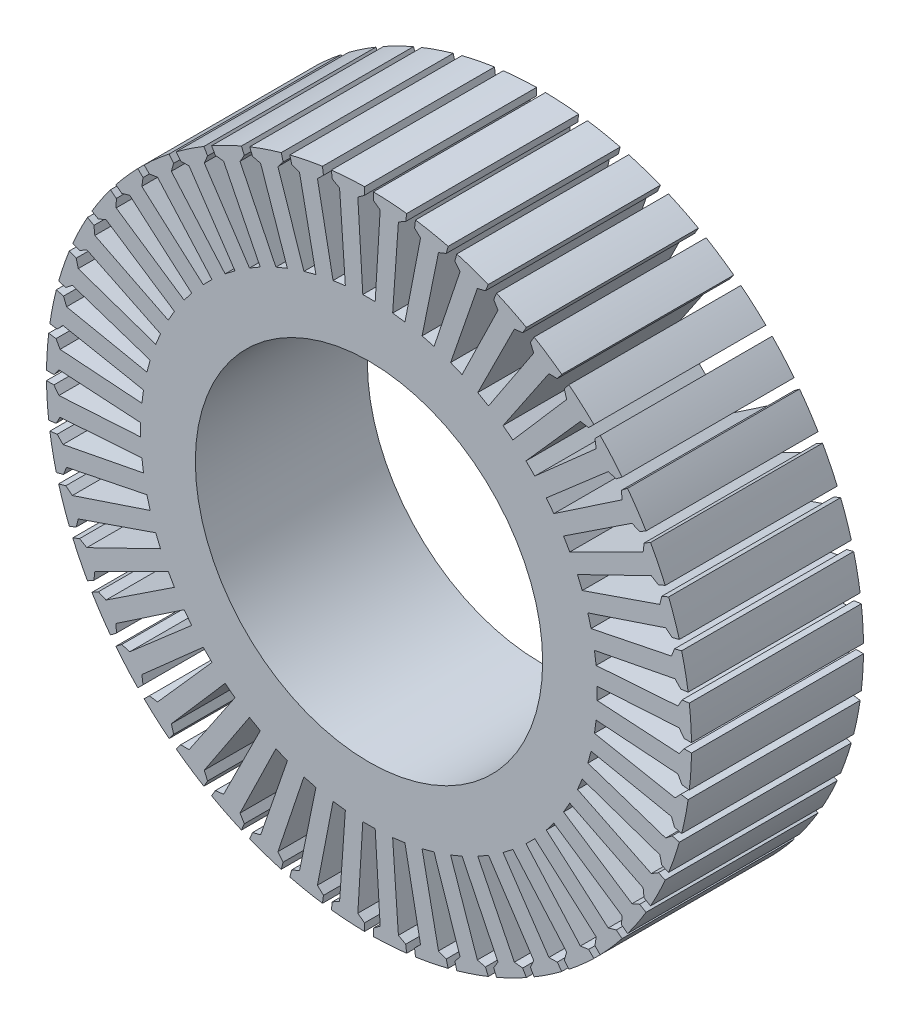
from build123d import *

# Parameters (mm, degrees)
STATOR_STACK_START    = -20
SKETCH_1_R            = 75
SKETCH_1_R_2          = 40.384615385
STATOR_STACK_DEPTH    = 40
STATOR_48_SLOTS_DEPTH = 21


with BuildPart() as part:
    # Эскиз1 → Stator_stack (new body)
    with BuildSketch(Plane.XY.offset(STATOR_STACK_START)):
        Circle(SKETCH_1_R)
        Circle(SKETCH_1_R_2, mode=Mode.SUBTRACT)
    extrude(amount=STATOR_STACK_DEPTH)

    # Эскиз2 → Stator_48_slots (cut, symmetric)
    with BuildSketch(Plane.XY):
        Polygon((75.992904916, -1.038461538), (73.269230769, -1.038461538), (72.115384615, -2.596153846), (53.076923077, -1.442307692), (53.076923077, 1.442307692), (72.115384615, 2.596153846), (73.269230769, 1.038461538), (75.992904916, 1.038461538), align=None)
        Polygon((75.478321511, 8.889487158), (72.777948773, 8.533976343), (71.837293579, 6.839003164), (52.811101573, 5.497960114), (52.434583711, 8.357897214), (71.159561427, 11.986889944), (72.506855913, 10.593131055), (75.20722865, 10.948641871), align=None)
        Polygon((73.672283097, 18.665334265), (71.041415896, 17.960395523), (70.330046532, 16.157142934), (51.64166748, 12.344156298), (50.89507408, 15.130480797), (68.986178413, 21.172527032), (70.503868649, 19.966549163), (73.13473585, 20.671487905), align=None)
        Polygon((70.605691494, 28.121812328), (68.089344696, 27.079507357), (67.61943289, 25.198829509), (49.588630138, 18.979140546), (48.484735621, 21.644177659), (65.632422761, 29.995896313), (67.294540645, 28.998334078), (69.810887442, 30.040639049), align=None)
        Polygon((66.331016934, 37.097118385), (63.972245931, 35.735281311), (63.751832004, 33.809357125), (46.687117585, 25.289386437), (45.244809893, 27.78753664), (61.155678158, 38.306027491), (62.933784393, 37.533949458), (65.292555396, 38.895786531), align=None)
        Polygon((60.921400284, 45.437682461), (58.760564301, 43.779614695), (58.793419596, 41.841397266), (42.986775507, 31.166923914), (41.230732924, 33.455443165), (55.632542946, 45.960731918), (57.496213641, 45.427348556), (59.657049624, 47.085416322), align=None)
        Polygon((54.469401584, 53.000795193), (52.543473125, 51.074866733), (52.829035479, 49.1575195), (38.550917782, 36.511186682), (36.511186682, 38.550917782), (49.1575195, 52.829035479), (51.074866733, 52.543473125), (53.000795193, 54.469401584), align=None)
        Polygon((47.085416322, 59.657049624), (45.427348556, 57.496213641), (45.960731918, 55.632542946), (33.455443165, 41.230732924), (31.166923914, 42.986775507), (41.841397266, 58.793419596), (43.779614695, 58.760564301), (45.437682461, 60.921400284), align=None)
        Polygon((38.895786531, 65.292555396), (37.533949458, 62.933784393), (38.306027491, 61.155678158), (27.78753664, 45.244809893), (25.289386437, 46.687117585), (33.809357125, 63.751832004), (35.735281311, 63.972245931), (37.097118385, 66.331016934), align=None)
        Polygon((30.040639049, 69.810887442), (28.998334078, 67.294540645), (29.995896313, 65.632422761), (21.644177659, 48.484735621), (18.979140546, 49.588630138), (25.198829509, 67.61943289), (27.079507357, 68.089344696), (28.121812328, 70.605691494), align=None)
        Polygon((20.671487905, 73.13473585), (19.966549163, 70.503868649), (21.172527032, 68.986178413), (15.130480797, 50.89507408), (12.344156298, 51.64166748), (16.157142934, 70.330046532), (17.960395523, 71.041415896), (18.665334265, 73.672283097), align=None)
        Polygon((10.948641871, 75.20722865), (10.593131055, 72.506855913), (11.986889944, 71.159561427), (8.357897214, 52.434583711), (5.497960114, 52.811101573), (6.839003164, 71.837293579), (8.533976343, 72.777948773), (8.889487158, 75.478321511), align=None)
        Polygon((1.038461538, 75.992904916), (1.038461538, 73.269230769), (2.596153846, 72.115384615), (1.442307692, 53.076923077), (-1.442307692, 53.076923077), (-2.596153846, 72.115384615), (-1.038461538, 73.269230769), (-1.038461538, 75.992904916), align=None)
        Polygon((-8.889487158, 75.478321511), (-8.533976343, 72.777948773), (-6.839003164, 71.837293579), (-5.497960114, 52.811101573), (-8.357897214, 52.434583711), (-11.986889944, 71.159561427), (-10.593131055, 72.506855913), (-10.948641871, 75.20722865), align=None)
        Polygon((-18.665334265, 73.672283097), (-17.960395523, 71.041415896), (-16.157142934, 70.330046532), (-12.344156298, 51.64166748), (-15.130480797, 50.89507408), (-21.172527032, 68.986178413), (-19.966549163, 70.503868649), (-20.671487905, 73.13473585), align=None)
        Polygon((-28.121812328, 70.605691494), (-27.079507357, 68.089344696), (-25.198829509, 67.61943289), (-18.979140546, 49.588630138), (-21.644177659, 48.484735621), (-29.995896313, 65.632422761), (-28.998334078, 67.294540645), (-30.040639049, 69.810887442), align=None)
        Polygon((-37.097118385, 66.331016934), (-35.735281311, 63.972245931), (-33.809357125, 63.751832004), (-25.289386437, 46.687117585), (-27.78753664, 45.244809893), (-38.306027491, 61.155678158), (-37.533949458, 62.933784393), (-38.895786531, 65.292555396), align=None)
        Polygon((-45.437682461, 60.921400284), (-43.779614695, 58.760564301), (-41.841397266, 58.793419596), (-31.166923914, 42.986775507), (-33.455443165, 41.230732924), (-45.960731918, 55.632542946), (-45.427348556, 57.496213641), (-47.085416322, 59.657049624), align=None)
        Polygon((-53.000795193, 54.469401584), (-51.074866733, 52.543473125), (-49.1575195, 52.829035479), (-36.511186682, 38.550917782), (-38.550917782, 36.511186682), (-52.829035479, 49.1575195), (-52.543473125, 51.074866733), (-54.469401584, 53.000795193), align=None)
        Polygon((-59.657049624, 47.085416322), (-57.496213641, 45.427348556), (-55.632542946, 45.960731918), (-41.230732924, 33.455443165), (-42.986775507, 31.166923914), (-58.793419596, 41.841397266), (-58.760564301, 43.779614695), (-60.921400284, 45.437682461), align=None)
        Polygon((-65.292555396, 38.895786531), (-62.933784393, 37.533949458), (-61.155678158, 38.306027491), (-45.244809893, 27.78753664), (-46.687117585, 25.289386437), (-63.751832004, 33.809357125), (-63.972245931, 35.735281311), (-66.331016934, 37.097118385), align=None)
        Polygon((-69.810887442, 30.040639049), (-67.294540645, 28.998334078), (-65.632422761, 29.995896313), (-48.484735621, 21.644177659), (-49.588630138, 18.979140546), (-67.61943289, 25.198829509), (-68.089344696, 27.079507357), (-70.605691494, 28.121812328), align=None)
        Polygon((-73.13473585, 20.671487905), (-70.503868649, 19.966549163), (-68.986178413, 21.172527032), (-50.89507408, 15.130480797), (-51.64166748, 12.344156298), (-70.330046532, 16.157142934), (-71.041415896, 17.960395523), (-73.672283097, 18.665334265), align=None)
        Polygon((-75.20722865, 10.948641871), (-72.506855913, 10.593131055), (-71.159561427, 11.986889944), (-52.434583711, 8.357897214), (-52.811101573, 5.497960114), (-71.837293579, 6.839003164), (-72.777948773, 8.533976343), (-75.478321511, 8.889487158), align=None)
        Polygon((-75.992904916, 1.038461538), (-73.269230769, 1.038461538), (-72.115384615, 2.596153846), (-53.076923077, 1.442307692), (-53.076923077, -1.442307692), (-72.115384615, -2.596153846), (-73.269230769, -1.038461538), (-75.992904916, -1.038461538), align=None)
        Polygon((-75.478321511, -8.889487158), (-72.777948773, -8.533976343), (-71.837293579, -6.839003164), (-52.811101573, -5.497960114), (-52.434583711, -8.357897214), (-71.159561427, -11.986889944), (-72.506855913, -10.593131055), (-75.20722865, -10.948641871), align=None)
        Polygon((-73.672283097, -18.665334265), (-71.041415896, -17.960395523), (-70.330046532, -16.157142934), (-51.64166748, -12.344156298), (-50.89507408, -15.130480797), (-68.986178413, -21.172527032), (-70.503868649, -19.966549163), (-73.13473585, -20.671487905), align=None)
        Polygon((-70.605691494, -28.121812328), (-68.089344696, -27.079507357), (-67.61943289, -25.198829509), (-49.588630138, -18.979140546), (-48.484735621, -21.644177659), (-65.632422761, -29.995896313), (-67.294540645, -28.998334078), (-69.810887442, -30.040639049), align=None)
        Polygon((-66.331016934, -37.097118385), (-63.972245931, -35.735281311), (-63.751832004, -33.809357125), (-46.687117585, -25.289386437), (-45.244809893, -27.78753664), (-61.155678158, -38.306027491), (-62.933784393, -37.533949458), (-65.292555396, -38.895786531), align=None)
        Polygon((-60.921400284, -45.437682461), (-58.760564301, -43.779614695), (-58.793419596, -41.841397266), (-42.986775507, -31.166923914), (-41.230732924, -33.455443165), (-55.632542946, -45.960731918), (-57.496213641, -45.427348556), (-59.657049624, -47.085416322), align=None)
        Polygon((-54.469401584, -53.000795193), (-52.543473125, -51.074866733), (-52.829035479, -49.1575195), (-38.550917782, -36.511186682), (-36.511186682, -38.550917782), (-49.1575195, -52.829035479), (-51.074866733, -52.543473125), (-53.000795193, -54.469401584), align=None)
        Polygon((-47.085416322, -59.657049624), (-45.427348556, -57.496213641), (-45.960731918, -55.632542946), (-33.455443165, -41.230732924), (-31.166923914, -42.986775507), (-41.841397266, -58.793419596), (-43.779614695, -58.760564301), (-45.437682461, -60.921400284), align=None)
        Polygon((-38.895786531, -65.292555396), (-37.533949458, -62.933784393), (-38.306027491, -61.155678158), (-27.78753664, -45.244809893), (-25.289386437, -46.687117585), (-33.809357125, -63.751832004), (-35.735281311, -63.972245931), (-37.097118385, -66.331016934), align=None)
        Polygon((-30.040639049, -69.810887442), (-28.998334078, -67.294540645), (-29.995896313, -65.632422761), (-21.644177659, -48.484735621), (-18.979140546, -49.588630138), (-25.198829509, -67.61943289), (-27.079507357, -68.089344696), (-28.121812328, -70.605691494), align=None)
        Polygon((-20.671487905, -73.13473585), (-19.966549163, -70.503868649), (-21.172527032, -68.986178413), (-15.130480797, -50.89507408), (-12.344156298, -51.64166748), (-16.157142934, -70.330046532), (-17.960395523, -71.041415896), (-18.665334265, -73.672283097), align=None)
        Polygon((-10.948641871, -75.20722865), (-10.593131055, -72.506855913), (-11.986889944, -71.159561427), (-8.357897214, -52.434583711), (-5.497960114, -52.811101573), (-6.839003164, -71.837293579), (-8.533976343, -72.777948773), (-8.889487158, -75.478321511), align=None)
        Polygon((-1.038461538, -75.992904916), (-1.038461538, -73.269230769), (-2.596153846, -72.115384615), (-1.442307692, -53.076923077), (1.442307692, -53.076923077), (2.596153846, -72.115384615), (1.038461538, -73.269230769), (1.038461538, -75.992904916), align=None)
        Polygon((8.889487158, -75.478321511), (8.533976343, -72.777948773), (6.839003164, -71.837293579), (5.497960114, -52.811101573), (8.357897214, -52.434583711), (11.986889944, -71.159561427), (10.593131055, -72.506855913), (10.948641871, -75.20722865), align=None)
        Polygon((18.665334265, -73.672283097), (17.960395523, -71.041415896), (16.157142934, -70.330046532), (12.344156298, -51.64166748), (15.130480797, -50.89507408), (21.172527032, -68.986178413), (19.966549163, -70.503868649), (20.671487905, -73.13473585), align=None)
        Polygon((28.121812328, -70.605691494), (27.079507357, -68.089344696), (25.198829509, -67.61943289), (18.979140546, -49.588630138), (21.644177659, -48.484735621), (29.995896313, -65.632422761), (28.998334078, -67.294540645), (30.040639049, -69.810887442), align=None)
        Polygon((37.097118385, -66.331016934), (35.735281311, -63.972245931), (33.809357125, -63.751832004), (25.289386437, -46.687117585), (27.78753664, -45.244809893), (38.306027491, -61.155678158), (37.533949458, -62.933784393), (38.895786531, -65.292555396), align=None)
        Polygon((45.437682461, -60.921400284), (43.779614695, -58.760564301), (41.841397266, -58.793419596), (31.166923914, -42.986775507), (33.455443165, -41.230732924), (45.960731918, -55.632542946), (45.427348556, -57.496213641), (47.085416322, -59.657049624), align=None)
        Polygon((53.000795193, -54.469401584), (51.074866733, -52.543473125), (49.1575195, -52.829035479), (36.511186682, -38.550917782), (38.550917782, -36.511186682), (52.829035479, -49.1575195), (52.543473125, -51.074866733), (54.469401584, -53.000795193), align=None)
        Polygon((59.657049624, -47.085416322), (57.496213641, -45.427348556), (55.632542946, -45.960731918), (41.230732924, -33.455443165), (42.986775507, -31.166923914), (58.793419596, -41.841397266), (58.760564301, -43.779614695), (60.921400284, -45.437682461), align=None)
        Polygon((65.292555396, -38.895786531), (62.933784393, -37.533949458), (61.155678158, -38.306027491), (45.244809893, -27.78753664), (46.687117585, -25.289386437), (63.751832004, -33.809357125), (63.972245931, -35.735281311), (66.331016934, -37.097118385), align=None)
        Polygon((69.810887442, -30.040639049), (67.294540645, -28.998334078), (65.632422761, -29.995896313), (48.484735621, -21.644177659), (49.588630138, -18.979140546), (67.61943289, -25.198829509), (68.089344696, -27.079507357), (70.605691494, -28.121812328), align=None)
        Polygon((73.13473585, -20.671487905), (70.503868649, -19.966549163), (68.986178413, -21.172527032), (50.89507408, -15.130480797), (51.64166748, -12.344156298), (70.330046532, -16.157142934), (71.041415896, -17.960395523), (73.672283097, -18.665334265), align=None)
        Polygon((75.20722865, -10.948641871), (72.506855913, -10.593131055), (71.159561427, -11.986889944), (52.434583711, -8.357897214), (52.811101573, -5.497960114), (71.837293579, -6.839003164), (72.777948773, -8.533976343), (75.478321511, -8.889487158), align=None)
    extrude(amount=STATOR_48_SLOTS_DEPTH, both=True, mode=Mode.SUBTRACT)


solid = part.part
